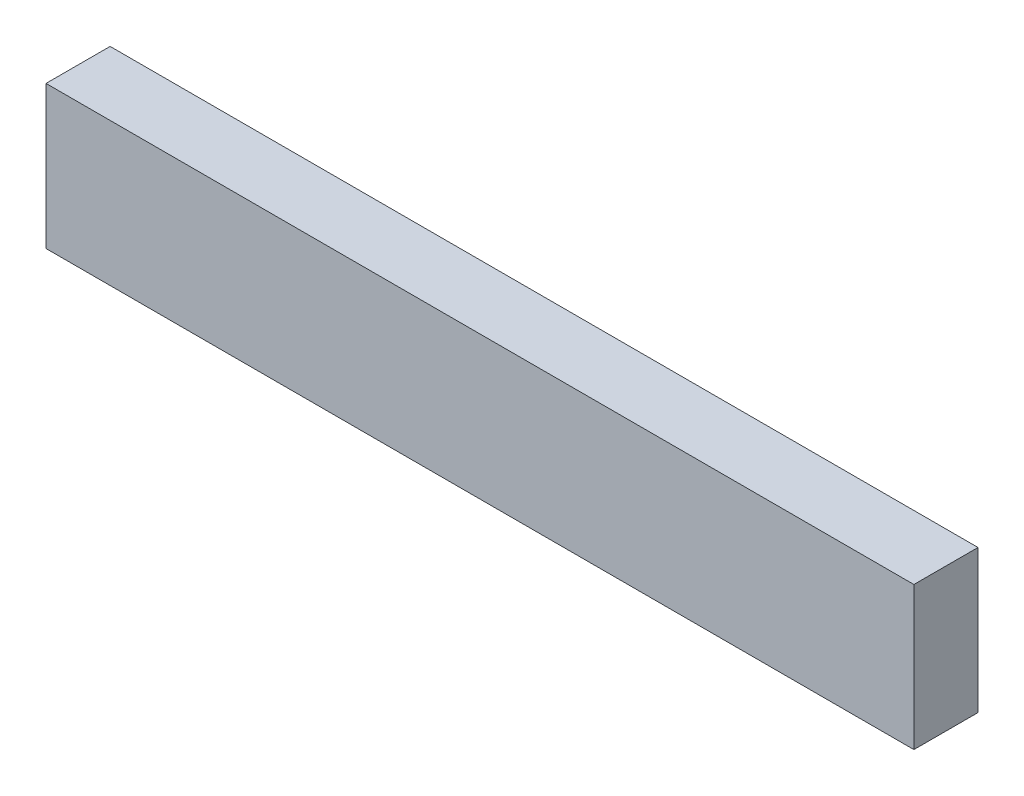
from build123d import *

# Parameters (mm, degrees)
SKETCH3_W           = 67.056
SKETCH3_H           = 4.953
BOSS_EXTRUDE1_DEPTH = 11.049


with BuildPart() as part:
    # Sketch3 → Boss-Extrude1 (new body)
    with BuildSketch(Plane(origin=(0, 0, 0), x_dir=(1, 0, 0), z_dir=(0, 1, 0))):
        with Locations((33.528, 2.4765)):
            Rectangle(SKETCH3_W, SKETCH3_H)
    extrude(amount=BOSS_EXTRUDE1_DEPTH)


solid = part.part
